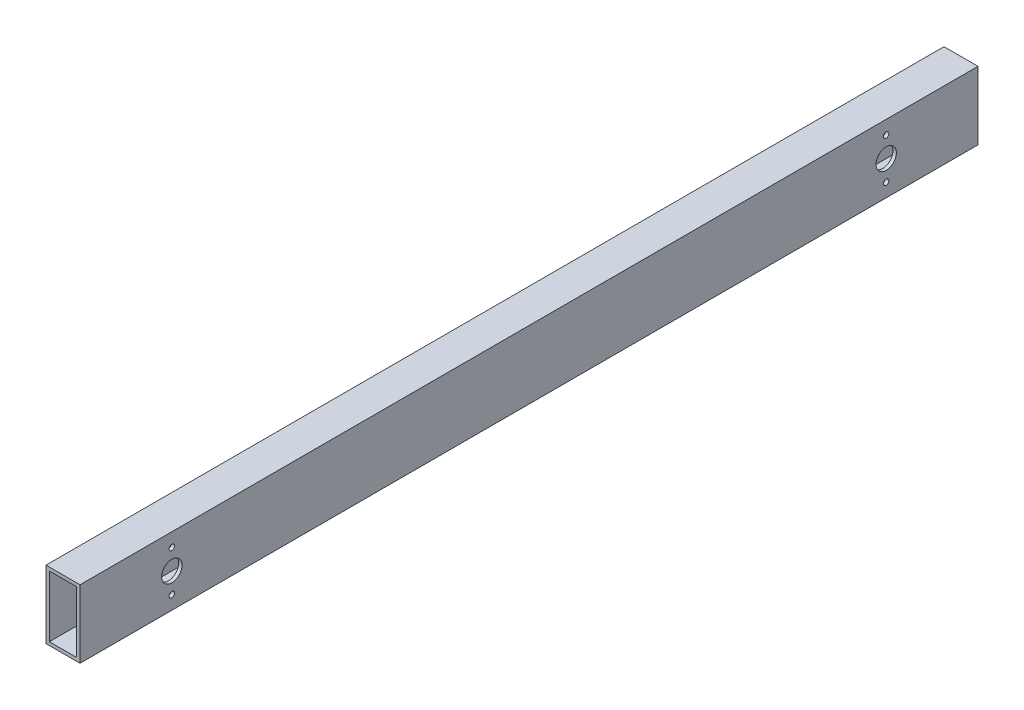
from build123d import *

# Parameters (mm, degrees)
SKETCH1_W           = 31.75
SKETCH1_H           = 63.5
SKETCH1_W_2         = 25.4
SKETCH1_H_2         = 57.15
BOSS_EXTRUDE1_DEPTH = 838.2
CUT_EXTRUDE1_REACH  = 843.015
SKETCH2_R           = 9.525
SKETCH2_R_2         = 2.54


with BuildPart() as part:
    # Sketch1 → Boss-Extrude1 (new body)
    with BuildSketch(Plane.XY):
        with Locations((3.710272719, -29.23968021)):
            Rectangle(SKETCH1_W, SKETCH1_H)
        with Locations((3.710272719, -29.23968021)):
            Rectangle(SKETCH1_W_2, SKETCH1_H_2, mode=Mode.SUBTRACT)
    extrude(amount=BOSS_EXTRUDE1_DEPTH)

    # Cut-Extrude1: up to this face of the body (flat: up to its plane)
    cut_extrude1_end = Plane(part.part.faces().sort_by_distance((-12.164727281, -29.23968021, 419.1))[0])
    # Sketch2 → Cut-Extrude1 (cut, up to the picked face)
    with BuildSketch(Plane(origin=(19.585272719, 0, 0), x_dir=(0, 0, -1), z_dir=(1, 0, 0)), mode=Mode.PRIVATE) as cut_extrude1_sk1:
        with Locations(Location((-752.475, -29.23968021, 0), (0, 0, 90))):
            Circle(SKETCH2_R)
    cut_extrude1_tool1 = split(extrude(cut_extrude1_sk1.sketch, amount=-CUT_EXTRUDE1_REACH, mode=Mode.PRIVATE), bisect_by=cut_extrude1_end, keep=Keep.BOTH, mode=Mode.PRIVATE)
    # Sketch2 → Cut-Extrude1 (cut, up to the picked face)
    with BuildSketch(Plane(origin=(19.585272719, 0, 0), x_dir=(0, 0, -1), z_dir=(1, 0, 0)), mode=Mode.PRIVATE) as cut_extrude1_sk2:
        with Locations(Location((-752.475, -48.28968021, 0), (0, 0, 90))):
            Circle(SKETCH2_R_2)
    cut_extrude1_tool2 = split(extrude(cut_extrude1_sk2.sketch, amount=-CUT_EXTRUDE1_REACH, mode=Mode.PRIVATE), bisect_by=cut_extrude1_end, keep=Keep.BOTH, mode=Mode.PRIVATE)
    # Sketch2 → Cut-Extrude1 (cut, up to the picked face)
    with BuildSketch(Plane(origin=(19.585272719, 0, 0), x_dir=(0, 0, -1), z_dir=(1, 0, 0)), mode=Mode.PRIVATE) as cut_extrude1_sk3:
        with Locations(Location((-752.475, -10.18968021, 0), (0, 0, 90))):
            Circle(SKETCH2_R_2)
    cut_extrude1_tool3 = split(extrude(cut_extrude1_sk3.sketch, amount=-CUT_EXTRUDE1_REACH, mode=Mode.PRIVATE), bisect_by=cut_extrude1_end, keep=Keep.BOTH, mode=Mode.PRIVATE)
    # Sketch2 → Cut-Extrude1 (cut, up to the picked face)
    with BuildSketch(Plane(origin=(19.585272719, 0, 0), x_dir=(0, 0, -1), z_dir=(1, 0, 0)), mode=Mode.PRIVATE) as cut_extrude1_sk4:
        with Locations(Location((-85.725, -48.28968021, 0), (0, 0, 270))):
            Circle(SKETCH2_R_2)
    cut_extrude1_tool4 = split(extrude(cut_extrude1_sk4.sketch, amount=-CUT_EXTRUDE1_REACH, mode=Mode.PRIVATE), bisect_by=cut_extrude1_end, keep=Keep.BOTH, mode=Mode.PRIVATE)
    # Sketch2 → Cut-Extrude1 (cut, up to the picked face)
    with BuildSketch(Plane(origin=(19.585272719, 0, 0), x_dir=(0, 0, -1), z_dir=(1, 0, 0)), mode=Mode.PRIVATE) as cut_extrude1_sk5:
        with Locations(Location((-85.725, -29.23968021, 0), (0, 0, 270))):
            Circle(SKETCH2_R)
    cut_extrude1_tool5 = split(extrude(cut_extrude1_sk5.sketch, amount=-CUT_EXTRUDE1_REACH, mode=Mode.PRIVATE), bisect_by=cut_extrude1_end, keep=Keep.BOTH, mode=Mode.PRIVATE)
    # Sketch2 → Cut-Extrude1 (cut, up to the picked face)
    with BuildSketch(Plane(origin=(19.585272719, 0, 0), x_dir=(0, 0, -1), z_dir=(1, 0, 0)), mode=Mode.PRIVATE) as cut_extrude1_sk6:
        with Locations(Location((-85.725, -10.18968021, 0), (0, 0, 270))):
            Circle(SKETCH2_R_2)
    cut_extrude1_tool6 = split(extrude(cut_extrude1_sk6.sketch, amount=-CUT_EXTRUDE1_REACH, mode=Mode.PRIVATE), bisect_by=cut_extrude1_end, keep=Keep.BOTH, mode=Mode.PRIVATE)
    add(cut_extrude1_tool1.solids().sort_by(Axis((19.585273, -29.23968, 752.475), (-1, 0, 0)))[0], mode=Mode.SUBTRACT)
    add(cut_extrude1_tool2.solids().sort_by(Axis((19.585273, -48.28968, 752.475), (-1, 0, 0)))[0], mode=Mode.SUBTRACT)
    add(cut_extrude1_tool3.solids().sort_by(Axis((19.585273, -10.18968, 752.475), (-1, 0, 0)))[0], mode=Mode.SUBTRACT)
    add(cut_extrude1_tool4.solids().sort_by(Axis((19.585273, -48.28968, 85.725), (-1, 0, 0)))[0], mode=Mode.SUBTRACT)
    add(cut_extrude1_tool5.solids().sort_by(Axis((19.585273, -29.23968, 85.725), (-1, 0, 0)))[0], mode=Mode.SUBTRACT)
    add(cut_extrude1_tool6.solids().sort_by(Axis((19.585273, -10.18968, 85.725), (-1, 0, 0)))[0], mode=Mode.SUBTRACT)


solid = part.part
